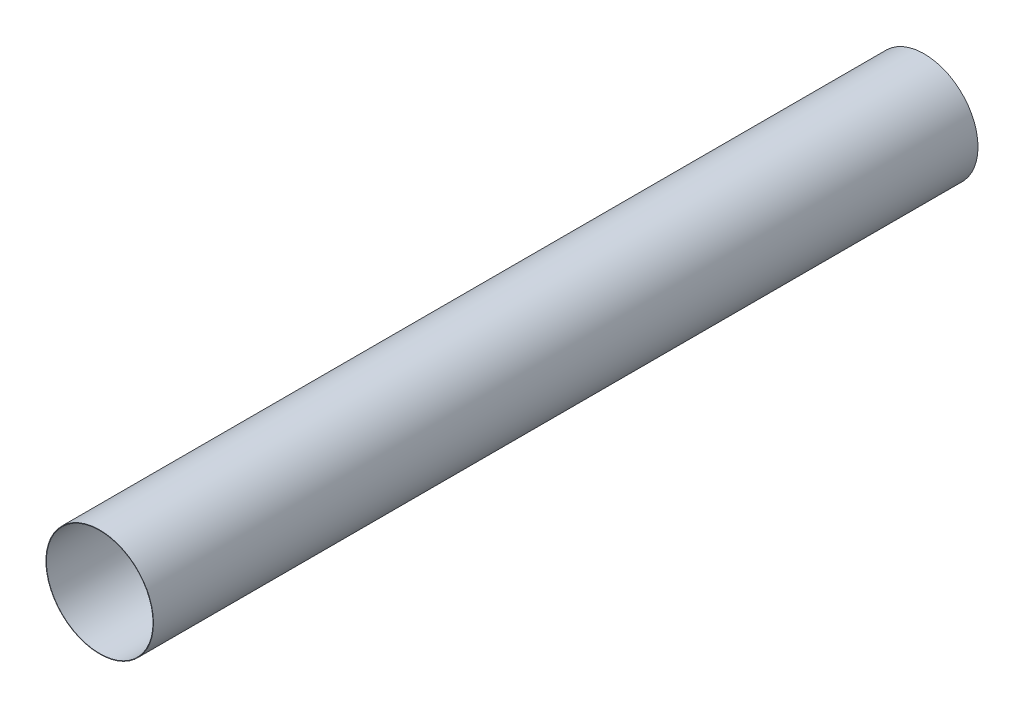
from build123d import *

# Parameters (mm, degrees)
SKETCH2_R           = 9.525
SKETCH2_R_2         = 9.4488
BOSS_EXTRUDE1_DEPTH = 146.05


with BuildPart() as part:
    # Sketch2 → Boss-Extrude1 (new body)
    with BuildSketch(Plane.XY):
        Circle(SKETCH2_R)
        Circle(SKETCH2_R_2, mode=Mode.SUBTRACT)
    extrude(amount=BOSS_EXTRUDE1_DEPTH)


solid = part.part
